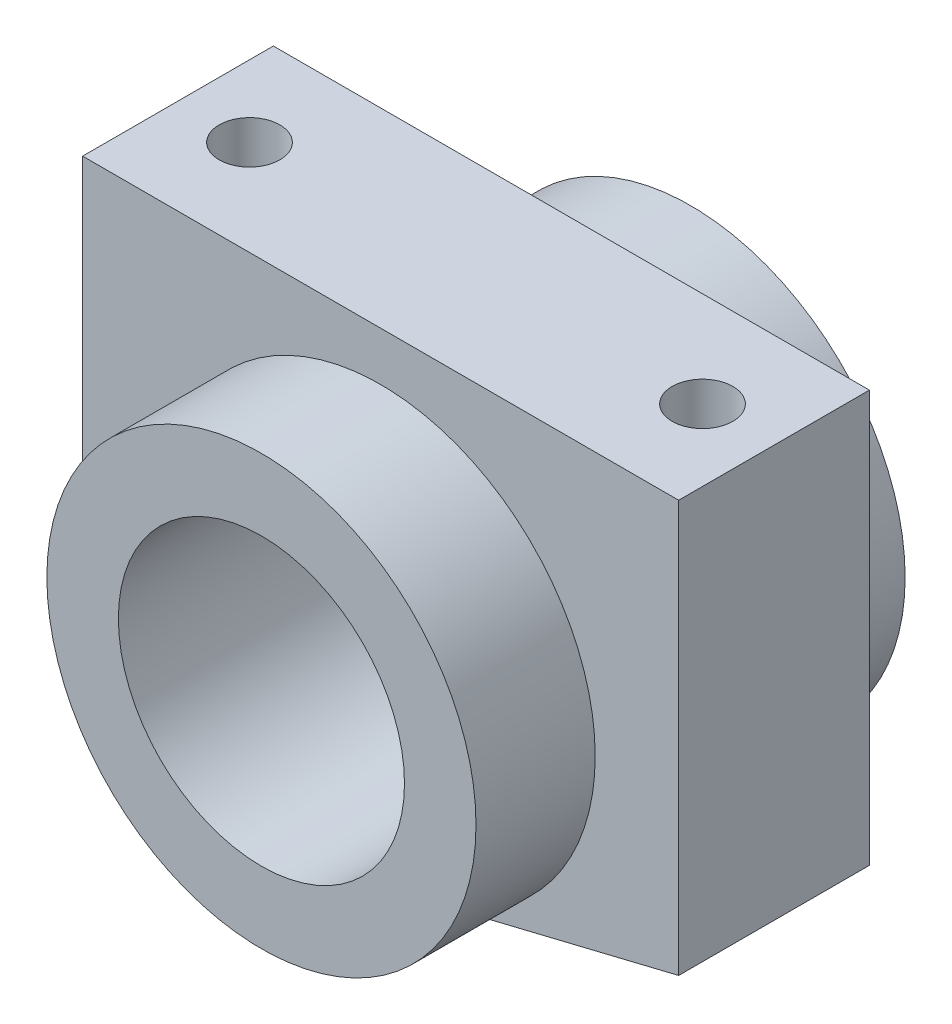
from build123d import *

# Parameters (mm, degrees)
SKETCH1_R               = 9.525
BOSS_EXTRUDE2_DEPTH     = 6.35
SKETCH2_R               = 14.2875
SKETCH2_R_2             = 9.525
BOSS_EXTRUDE3_DEPTH     = 14.2875
SKETCH6_R               = 2.0193
CUT_EXTRUDE1_DEPTH      = 17.4625
CUT_EXTRUDE2_DEPTH      = 31.047395504
CUT_EXTRUDE2_DEPTH_BACK = 31.047395504
SKETCH9_R               = 2.0193


with BuildPart() as part:
    # Sketch1 → Boss-Extrude2 (new, symmetric)
    with BuildSketch(Plane.XY):
        Polygon((19.84375, 0), (-19.84375, 0), (-19.84375, -17.4625), (-19.84375, -27.406149544), (0, -32.238619559), (19.84375, -27.406149544), (19.84375, -17.4625), align=None)
        with Locations((0, -17.533511157)):
            Circle(SKETCH1_R, mode=Mode.SUBTRACT)
    extrude(amount=BOSS_EXTRUDE2_DEPTH, both=True)

    # Sketch2 → Boss-Extrude3 (add, symmetric)
    with BuildSketch(Plane.XY):
        with Locations(Location((0, -17.533511157, 0), (0, 0, 180))):
            Circle(SKETCH2_R)
        with Locations((0, -17.533511157)):
            Circle(SKETCH2_R_2, mode=Mode.SUBTRACT)
    extrude(amount=BOSS_EXTRUDE3_DEPTH, both=True)

    # Sketch6 → Cut-Extrude1 (cut)
    with BuildSketch(Plane(origin=(0, 0, 0), x_dir=(1, 0, 0), z_dir=(0, 1, 0))):
        with Locations(Location((-15.08125, 0, 0), (0, 0, 270))):
            Circle(SKETCH6_R)
        with Locations(Location((15.08125, 0, 0), (0, 0, 90))):
            Circle(SKETCH6_R)
    extrude(amount=-CUT_EXTRUDE1_DEPTH, mode=Mode.SUBTRACT)

    # Sketch9 → Cut-Extrude2 (cut, two sides: drawn at the far end of the back side and taken through both)
    with BuildSketch(Plane(origin=(0, -17.4625, 0), x_dir=(1, 0, 0), z_dir=(0, 1, 0)).offset(-CUT_EXTRUDE2_DEPTH_BACK)):
        with Locations(Location((-15.08125, 0, 0), (0, 0, 270))):
            Circle(SKETCH9_R)
        with Locations((15.08125, 0)):
            Circle(SKETCH9_R)
    extrude(amount=CUT_EXTRUDE2_DEPTH + CUT_EXTRUDE2_DEPTH_BACK, mode=Mode.SUBTRACT)


solid = part.part
